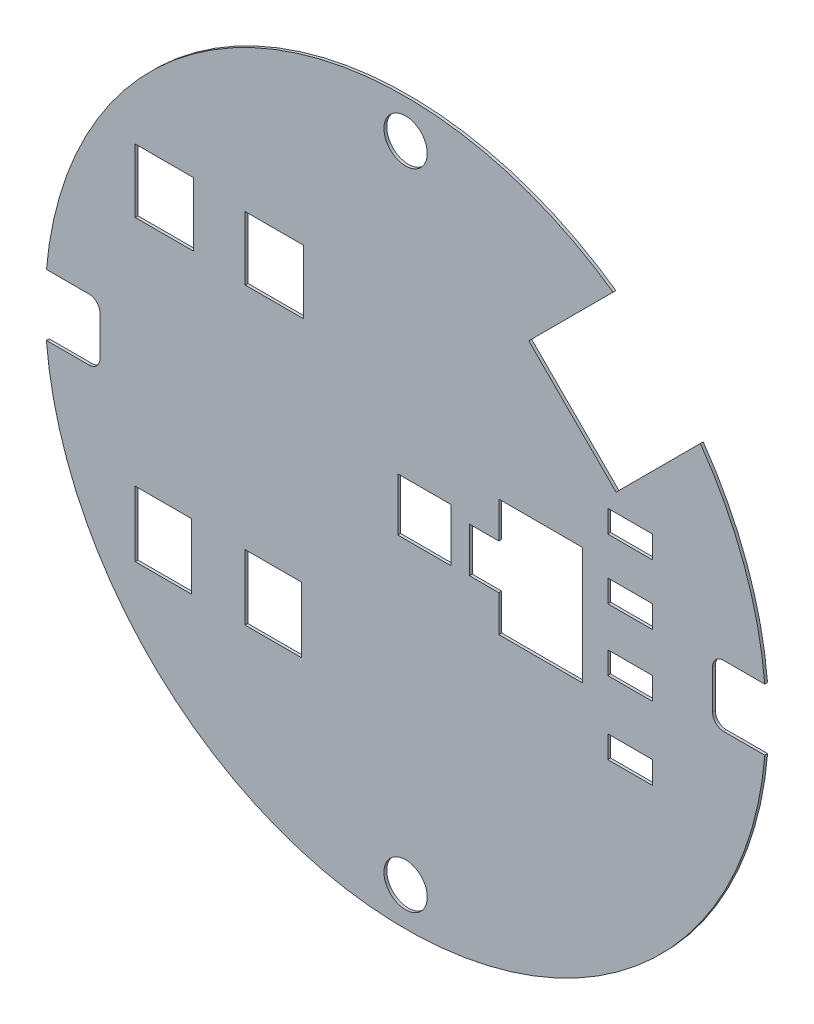
from build123d import *

# Parameters (mm, degrees)
EXTRUDE_START       = -3.8
SKETCH_1_R          = 25.801076528
SKETCH_1_R_2        = 1.549997321
SKETCH_1_R_3        = 1.54999944
EXTRUDE_1_DEPTH     = 0.2
CUT_EXTRUDE_START   = -3.8
SKETCH_2_W          = 3.794
SKETCH_2_H          = 3.794
SKETCH_2_W_2        = 4.175
SKETCH_2_H_2        = 4.556
SKETCH_2_W_3        = 4.048
SKETCH_2_H_3        = 4.683
CUT_EXTRUDE_1_DEPTH = 0.2
CUT_EXTRUDE_2_DEPTH = 0.2
CUT_EXTRUDE_3_DEPTH = 0.2
CUT_EXTRUDE_4_DEPTH = 0.2
CUT_EXTRUDE_5_DEPTH = 0.2


with BuildPart() as part:
    # 草图1 → 凸台-拉伸1 (new body)
    with BuildSketch(Plane(origin=(0, 0, -54.8040151), x_dir=(-1, 0, 0), z_dir=(0, 0, -1)).offset(EXTRUDE_START)):
        with Locations(Location((24.698490112, -1.512152456, 0), (0, 0, 180))):
            Circle(SKETCH_1_R)
        with Locations(Location((24.698490112, 21.537847164, 0), (0, 0, 180))):
            Circle(SKETCH_1_R_2, mode=Mode.SUBTRACT)
        with Locations(Location((24.698490112, -24.562152076, 0), (0, 0, 180))):
            Circle(SKETCH_1_R_3, mode=Mode.SUBTRACT)
    extrude(amount=EXTRUDE_1_DEPTH)

    # 草图2 → 切除-拉伸1 (cut)
    with BuildSketch(Plane(origin=(0, 0, -54.8040151), x_dir=(-1, 0, 0), z_dir=(0, 0, -1)).offset(CUT_EXTRUDE_START)):
        with Locations((23.362494109, -1.270150744)):
            Rectangle(SKETCH_2_W, SKETCH_2_H)
        with Locations((34.093992827, 9.14385072)):
            Rectangle(SKETCH_2_W_2, SKETCH_2_H_2)
        with Locations((41.967993376, 9.397848523)):
            Rectangle(SKETCH_2_W_2, SKETCH_2_H_2)
        with Locations((34.157492278, -11.874650561)):
            Rectangle(SKETCH_2_W_3, SKETCH_2_H_3)
        with Locations((42.031492827, -11.874650561)):
            Rectangle(SKETCH_2_W_3, SKETCH_2_H_3)
    extrude(amount=CUT_EXTRUDE_1_DEPTH, mode=Mode.SUBTRACT)

    # 草图3 → 切除-拉伸2 (cut)
    with BuildSketch(Plane(origin=(0, 0, -54.8040151), x_dir=(-1, 0, 0), z_dir=(0, 0, -1)).offset(CUT_EXTRUDE_START)):
        Polygon((15.882224059, 13.556279819), (9.63139829, 7.305454051), (2.996403479, 13.940448863), (9.247230868, 20.191276253), align=None)
    extrude(amount=CUT_EXTRUDE_2_DEPTH, mode=Mode.SUBTRACT)

    # 草图4 → 切除-拉伸3 (cut)
    with BuildSketch(Plane(origin=(0, 0, -54.8040151), x_dir=(-1, 0, 0), z_dir=(0, 0, -1)).offset(CUT_EXTRUDE_START)):
        Polygon((7.030438471, 4.406785556), (7.030438471, 6.006785556), (10.230438471, 6.006785556), (10.230438471, 4.406785556), (8.630438471, 4.406785556), align=None)
        Polygon((7.030438471, 0.086785556), (7.030438471, 1.686785556), (10.230438471, 1.686785556), (10.230438471, 0.086785556), (8.630438471, 0.086785556), align=None)
        Polygon((7.030438471, -4.363214444), (7.030438471, -2.763214444), (10.230438471, -2.763214444), (10.230438471, -4.363214444), (8.630438471, -4.363214444), align=None)
        Polygon((7.030438471, -9.573214444), (7.030438471, -7.973214444), (10.230438471, -7.973214444), (10.230438471, -9.573214444), (8.630438471, -9.573214444), align=None)
    extrude(amount=CUT_EXTRUDE_3_DEPTH, mode=Mode.SUBTRACT)

    # 草图5 → 切除-拉伸4 (cut)
    with BuildSketch(Plane(origin=(0, 0, -54.8040151), x_dir=(-1, 0, 0), z_dir=(0, 0, -1)).offset(CUT_EXTRUDE_START)):
        Polygon((14.853491423, 2.675851453), (12.053491423, 2.675851453), (12.053491423, -5.724148547), (14.853491423, -5.724148547), (18.028494414, -5.724148547), (18.028494414, -3.124148547), (20.128494414, -3.124148547), (20.128494414, 0.075851453), (18.028494414, 0.075851453), (18.028494414, 2.675851453), (17.653491423, 2.675851453), align=None)
    extrude(amount=CUT_EXTRUDE_4_DEPTH, mode=Mode.SUBTRACT)

    # 草图7 → 切除-拉伸5 (cut)
    with BuildSketch(Plane(origin=(0, 0, -54.8040151), x_dir=(-1, 0, 0), z_dir=(0, 0, -1)).offset(CUT_EXTRUDE_START)):
        with BuildLine():
            Line((50.959593828, -3.679110402), (50.311348997, -3.679110402))
            Line((50.311348997, -3.679110402), (47.368920104, -3.679058566))
            ThreePointArc((47.368920104, -3.679058566), (46.803238807, -3.444734025), (46.568934198, -2.879044472))
            Line((46.568934198, -2.879044472), (46.568983525, -0.079044473))
            ThreePointArc((46.568983525, -0.079044473), (46.803308066, 0.486636824), (47.368997619, 0.720941434))
            Line((47.368997619, 0.720941434), (50.305693305, 0.720889698))
            Line((50.305693305, 0.720889698), (50.959593828, 0.720889698))
            Line((50.959593828, 0.720889698), (50.959593828, -3.679110402))
        make_face()
        with BuildLine():
            Line((-1.005097138, 0.720889698), (1.931598548, 0.720941434))
            ThreePointArc((1.931598548, 0.720941434), (2.497288101, 0.486636824), (2.731612641, -0.079044473))
            Line((2.731612641, -0.079044473), (2.731661969, -2.879044472))
            ThreePointArc((2.731661969, -2.879044472), (2.49735736, -3.444734025), (1.931676063, -3.679058566))
            Line((1.931676063, -3.679058566), (-1.01075283, -3.679110402))
            Line((-1.01075283, -3.679110402), (-1.658997661, -3.679110402))
            Line((-1.658997661, -3.679110402), (-1.658997661, 0.720889698))
            Line((-1.658997661, 0.720889698), (-1.005097138, 0.720889698))
        make_face()
    extrude(amount=CUT_EXTRUDE_5_DEPTH, mode=Mode.SUBTRACT)


solid = part.part
